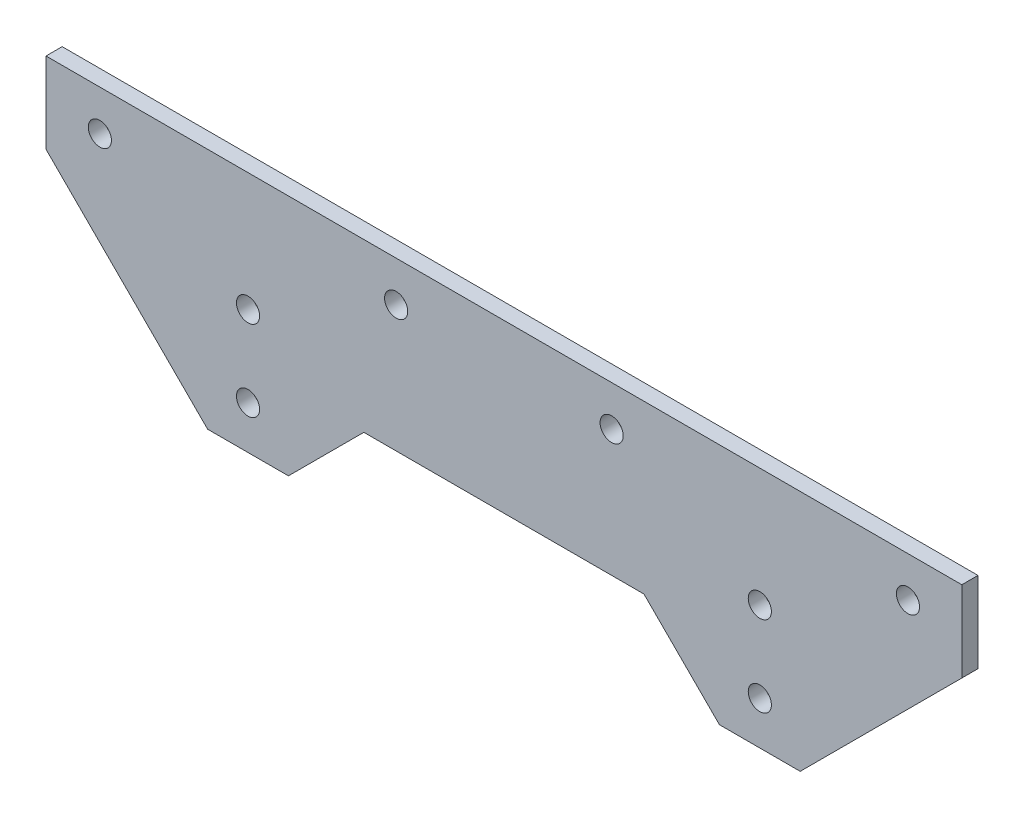
from build123d import *

# Parameters (mm, degrees)
SKETCH1_R      = 2.15
EXTRUDE1_DEPTH = 3


with BuildPart() as part:
    # Sketch1 → Extrude1 (new body)
    with BuildSketch(Plane.XY):
        Polygon((-85, 225.999923245), (-85, 210.999923245), (-55, 180.999923245), (-40, 180.999923245), (-26, 194.999923245), (26, 194.999923245), (40, 180.999923245), (55, 180.999923245), (85, 210.999923245), (85, 225.999923245), align=None)
        with Locations((-47.5, 188.999923245)):
            Circle(SKETCH1_R, mode=Mode.SUBTRACT)
        with Locations((-47.5, 203.999923245)):
            Circle(SKETCH1_R, mode=Mode.SUBTRACT)
        with Locations((-75, 218.499923245)):
            Circle(SKETCH1_R, mode=Mode.SUBTRACT)
        with Locations((-20, 218.499923245)):
            Circle(SKETCH1_R, mode=Mode.SUBTRACT)
        with Locations(Location((47.5, 188.999923245, 0), (0, 0, 180))):
            Circle(SKETCH1_R, mode=Mode.SUBTRACT)
        with Locations(Location((47.5, 203.999923245, 0), (0, 0, 180))):
            Circle(SKETCH1_R, mode=Mode.SUBTRACT)
        with Locations(Location((20, 218.499923245, 0), (0, 0, 180))):
            Circle(SKETCH1_R, mode=Mode.SUBTRACT)
        with Locations(Location((75, 218.499923245, 0), (0, 0, 180))):
            Circle(SKETCH1_R, mode=Mode.SUBTRACT)
    extrude(amount=EXTRUDE1_DEPTH)


solid = part.part
